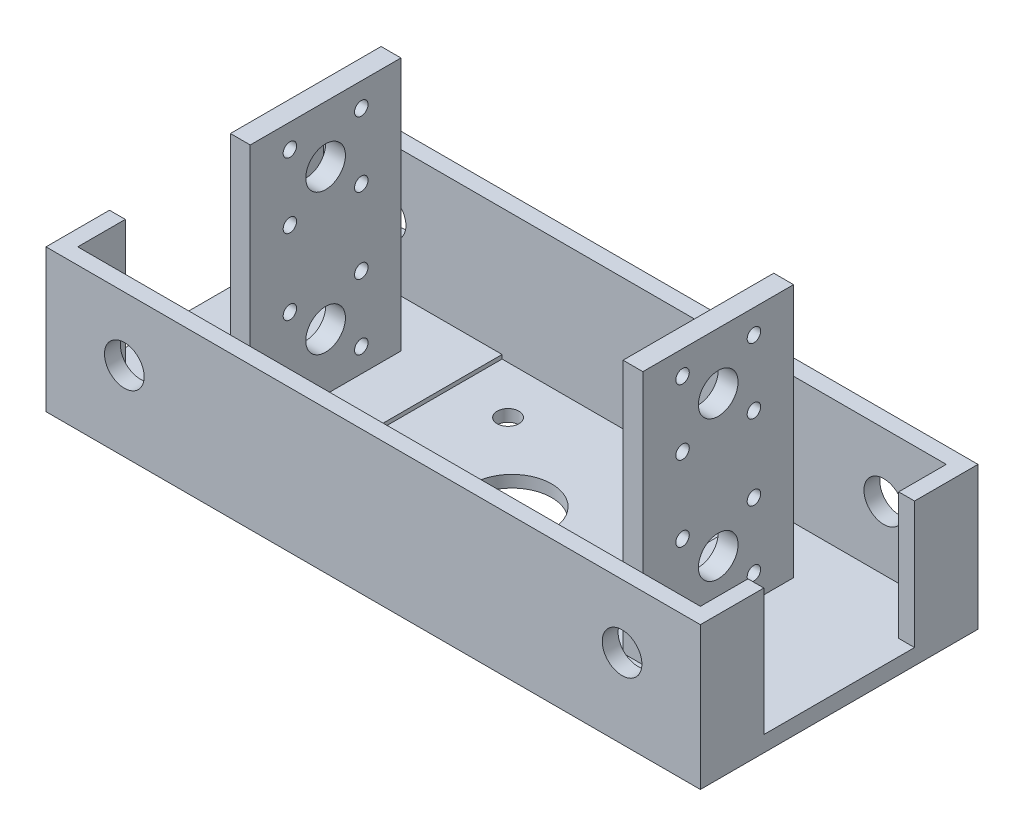
from build123d import *

# Parameters (mm, degrees)
SKETCH1_W                 = 75
SKETCH1_H                 = 40
SKETCH1_R                 = 5
SKETCH1_R_2               = 1.7
SKETCH1_W_2               = 10
SKETCH1_H_2               = 20
BOSS_EXTRUDE1_DEPTH       = 3
CUT_EXTRUDE1_DEPTH        = 43.605750786
CUT_EXTRUDE1_DEPTH_BACK   = 43.605750786
SKETCH2_W                 = 67
SKETCH2_H                 = 28
BOSS_EXTRUDE3_DEPTH       = 110
BOSS_EXTRUDE3_DEPTH_BACK  = 3
SKETCH6_W                 = 67
SKETCH6_H                 = 11
CUT_EXTRUDE4_DEPTH        = 122.372360939
SKETCH7_W                 = 70
SKETCH7_H                 = 37
BOSS_EXTRUDE4_DEPTH       = 45
SKETCH8_W                 = 45
SKETCH8_H                 = 62
CUT_EXTRUDE6_DEPTH        = 29
SKETCH11_W                = 45
SKETCH11_H                = 4
CUT_EXTRUDE9_DEPTH        = 157.445677473
SKETCH9_W                 = 38
SKETCH9_H                 = 28.5
CUT_EXTRUDE10_DEPTH       = 204.024629048
SKETCH13_W                = 5
SKETCH13_H                = 38
BOSS_EXTRUDE5_DEPTH       = 32
SKETCH14_R                = 5
SKETCH14_R_2              = 1.7
CUT_EXTRUDE11_DEPTH       = 32
SKETCH15_W                = 165
SKETCH15_H                = 70
SKETCH15_W_2              = 157
SKETCH15_H_2              = 62
BOSS_EXTRUDE6_DEPTH       = 3
SKETCH16_W                = 20
SKETCH16_H                = 4.820648258
CUT_EXTRUDE12_DEPTH       = 159.626132778
SKETCH18_R                = 5
CUT_EXTRUDE14_DEPTH       = 159.626132778
MIRROR6_COPY_1_SKETCH_W   = 5
MIRROR6_COPY_1_SKETCH_H   = 38
MIRROR6_COPY_1_DEPTH      = 32
MIRROR6_COPY_2_SKETCH_R   = 5
MIRROR6_COPY_2_SKETCH_R_2 = 1.7
MIRROR6_COPY_2_DEPTH      = 32
SKETCH19_W                = 38
SKETCH19_H                = 3.5
CUT_EXTRUDE15_DEPTH       = 10
SKETCH20_R                = 1.2
CUT_EXTRUDE16_DEPTH       = 10
SKETCH21_W                = 10
SKETCH21_H                = 80
CUT_EXTRUDE17_DEPTH       = 184.330984833
SKETCH22_W                = 55
SKETCH22_H                = 80
CUT_EXTRUDE18_DEPTH       = 184.330984833
SKETCH23_W                = 67
SKETCH23_H                = 62
BOSS_EXTRUDE7_DEPTH       = 3
SKETCH24_R                = 10
SKETCH24_R_2              = 2.75
CUT_EXTRUDE19_DEPTH       = 111.707949127


with BuildPart() as part:
    # Sketch1 → Boss-Extrude1 (new body)
    with BuildSketch(Plane(origin=(0, 0, 0), x_dir=(1, 0, 0), z_dir=(0, 1, 0))):
        Rectangle(SKETCH1_W, SKETCH1_H)
        with Locations(Location((-21, 0, 0), (0, 0, 270))):
            Circle(SKETCH1_R, mode=Mode.SUBTRACT)
        with Locations(Location((-30, 8.25, 0), (0, 0, 270))):
            Circle(SKETCH1_R_2, mode=Mode.SUBTRACT)
        with Locations(Location((-12, 8.25, 0), (0, 0, 270))):
            Circle(SKETCH1_R_2, mode=Mode.SUBTRACT)
        with Locations(Location((-12, -8.25, 0), (0, 0, 270))):
            Circle(SKETCH1_R_2, mode=Mode.SUBTRACT)
        with Locations(Location((-30, -8.25, 0), (0, 0, 270))):
            Circle(SKETCH1_R_2, mode=Mode.SUBTRACT)
        with Locations(Location((12, 8.25, 0), (0, 0, 90))):
            Circle(SKETCH1_R_2, mode=Mode.SUBTRACT)
        with Locations(Location((12, -8.25, 0), (0, 0, 90))):
            Circle(SKETCH1_R_2, mode=Mode.SUBTRACT)
        with Locations(Location((21, 0, 0), (0, 0, 90))):
            Circle(SKETCH1_R, mode=Mode.SUBTRACT)
        with Locations(Location((30, -8.25, 0), (0, 0, 90))):
            Circle(SKETCH1_R_2, mode=Mode.SUBTRACT)
        with Locations(Location((30, 8.25, 0), (0, 0, 90))):
            Circle(SKETCH1_R_2, mode=Mode.SUBTRACT)
        Rectangle(SKETCH1_W_2, SKETCH1_H_2, mode=Mode.SUBTRACT)
    extrude(amount=BOSS_EXTRUDE1_DEPTH)

    # Sketch2 → Cut-Extrude1 (cut, two sides: drawn at the far end of the back side and taken through both)
    with BuildSketch(Plane(origin=(0, 3, 0), x_dir=(1, 0, 0), z_dir=(0, 1, 0)).offset(-CUT_EXTRUDE1_DEPTH_BACK)):
        Rectangle(SKETCH2_W, SKETCH2_H)
    extrude(amount=CUT_EXTRUDE1_DEPTH + CUT_EXTRUDE1_DEPTH_BACK, mode=Mode.SUBTRACT)

    # Sketch3 → Boss-Extrude3 (add, two sides: drawn at the far end of the back side and taken through both)
    with BuildSketch(Plane(origin=(0, 3, 0), x_dir=(1, 0, 0), z_dir=(0, 1, 0)).offset(-BOSS_EXTRUDE3_DEPTH_BACK)):
        Polygon((37.5, -35), (37.5, -20), (33.5, -20), (-33.5, -20), (-37.5, -20), (-37.5, -35), align=None)
        Polygon((33.5, 20), (37.5, 20), (37.5, 35), (-37.5, 35), (-37.5, 20), (-33.5, 20), align=None)
        Polygon((37.5, -20), (37.5, 20), (33.5, 20), (33.5, 14), (33.5, -14), (33.5, -20), align=None)
        Polygon((-33.5, 14), (-33.5, 20), (-37.5, 20), (-37.5, -20), (-33.5, -20), (-33.5, -14), align=None)
    extrude(amount=BOSS_EXTRUDE3_DEPTH + BOSS_EXTRUDE3_DEPTH_BACK)

    # Sketch6 → Cut-Extrude4 (cut, through all)
    with BuildSketch(Plane(origin=(0, 3, 0), x_dir=(1, 0, 0), z_dir=(0, 1, 0))):
        with Locations((0, -25.5)):
            Rectangle(SKETCH6_W, SKETCH6_H)
        with Locations((0, 25.5)):
            Rectangle(SKETCH6_W, SKETCH6_H)
    extrude(amount=CUT_EXTRUDE4_DEPTH, mode=Mode.SUBTRACT)

    # Sketch7 → Boss-Extrude4 (add)
    with BuildSketch(Plane.ZY.offset(37.5)):
        with Locations((0, 94.5)):
            Rectangle(SKETCH7_W, SKETCH7_H)
    boss_extrude4 = extrude(amount=BOSS_EXTRUDE4_DEPTH)

    # Mirror2: Boss-Extrude4 across plane
    add(boss_extrude4.mirror(Plane(origin=(0, 0, 0), x_dir=(0, 0, 1), z_dir=(1, 0, 0))))

    # Sketch8 → Cut-Extrude6 (cut)
    with BuildSketch(Plane(origin=(0, 113, 0), x_dir=(1, 0, 0), z_dir=(0, 1, 0))):
        with Locations((-56, 0)):
            Rectangle(SKETCH8_W, SKETCH8_H)
        with Locations((56, 0)):
            Rectangle(SKETCH8_W, SKETCH8_H)
    extrude(amount=-CUT_EXTRUDE6_DEPTH, mode=Mode.SUBTRACT)

    # Sketch11 → Cut-Extrude9 (cut, through all)
    with BuildSketch(Plane.XY.offset(35)):
        with Locations((-60, 78)):
            Rectangle(SKETCH11_W, SKETCH11_H)
        with Locations((60, 78)):
            Rectangle(SKETCH11_W, SKETCH11_H)
    extrude(amount=-CUT_EXTRUDE9_DEPTH, mode=Mode.SUBTRACT)

    # Sketch9 → Cut-Extrude10 (cut, through all)
    with BuildSketch(Plane.ZY.offset(82.5)):
        with Locations((0, 98.25)):
            Rectangle(SKETCH9_W, SKETCH9_H)
    extrude(amount=-CUT_EXTRUDE10_DEPTH, mode=Mode.SUBTRACT)

    # Sketch13 → Boss-Extrude5 (add)
    with BuildSketch(Plane(origin=(0, 84, 0), x_dir=(1, 0, 0), z_dir=(0, 1, 0))):
        with Locations((-49.5, 0)):
            Rectangle(SKETCH13_W, SKETCH13_H)
    boss_extrude5 = extrude(amount=BOSS_EXTRUDE5_DEPTH)

    # Sketch14 → Cut-Extrude11 (cut)
    with BuildSketch(Plane.ZY.offset(52)):
        with Locations((0, 98.25)):
            Circle(SKETCH14_R)
        with Locations((-9, 106.5)):
            Circle(SKETCH14_R_2)
        with Locations((9, 106.5)):
            Circle(SKETCH14_R_2)
        with Locations((9, 90)):
            Circle(SKETCH14_R_2)
        with Locations((-9, 90)):
            Circle(SKETCH14_R_2)
    cut_extrude11 = extrude(amount=-CUT_EXTRUDE11_DEPTH, mode=Mode.SUBTRACT)

    # Mirror4: Boss-Extrude5, Cut-Extrude11 across plane
    add(boss_extrude5.mirror(Plane(origin=(0, 0, 0), x_dir=(0, 0, 1), z_dir=(1, 0, 0))))
    add(cut_extrude11.mirror(Plane(origin=(0, 0, 0), x_dir=(0, 0, 1), z_dir=(1, 0, 0))), mode=Mode.SUBTRACT)

    # Sketch15 → Boss-Extrude6 (add)
    with BuildSketch(Plane(origin=(0, 113, 0), x_dir=(1, 0, 0), z_dir=(0, 1, 0))):
        Rectangle(SKETCH15_W, SKETCH15_H)
        Rectangle(SKETCH15_W_2, SKETCH15_H_2, mode=Mode.SUBTRACT)
    extrude(amount=BOSS_EXTRUDE6_DEPTH)

    # Sketch16 → Cut-Extrude12 (cut, through all)
    with BuildSketch(Plane.XY.offset(35)):
        with Locations((0, 11.636111214)):
            Rectangle(SKETCH16_W, SKETCH16_H)
    extrude(amount=-CUT_EXTRUDE12_DEPTH, mode=Mode.SUBTRACT)

    # Sketch18 → Cut-Extrude14 (cut, through all)
    with BuildSketch(Plane.XY.offset(35)):
        with Locations((62.75, 100)):
            Circle(SKETCH18_R)
    cut_extrude14 = extrude(amount=-CUT_EXTRUDE14_DEPTH, mode=Mode.SUBTRACT)

    # Mirror5: Cut-Extrude14 across plane
    add(cut_extrude14.mirror(Plane(origin=(0, 0, 0), x_dir=(0, 0, 1), z_dir=(1, 0, 0))), mode=Mode.SUBTRACT)

    # Mirror6: Boss-Extrude5, Cut-Extrude11 across plane
    add(boss_extrude5.mirror(Plane.ZX.offset(116)))
    add(cut_extrude11.mirror(Plane.ZX.offset(116)), mode=Mode.SUBTRACT)

    # Mirror6 copy 1 sketch → Mirror6 copy 1 (add)
    with BuildSketch(Plane(origin=(0, 148, 0), x_dir=(-1, 0, 0), z_dir=(0, -1, 0))):
        with Locations((-49.5, 0)):
            Rectangle(MIRROR6_COPY_1_SKETCH_W, MIRROR6_COPY_1_SKETCH_H)
    extrude(amount=MIRROR6_COPY_1_DEPTH)

    # Mirror6 copy 2 sketch → Mirror6 copy 2 (cut)
    with BuildSketch(Plane(origin=(52, 232, 0), x_dir=(0, 0, 1), z_dir=(1, 0, 0))):
        with Locations((0, 98.25)):
            Circle(MIRROR6_COPY_2_SKETCH_R)
        with Locations((-9, 106.5)):
            Circle(MIRROR6_COPY_2_SKETCH_R_2)
        with Locations((9, 106.5)):
            Circle(MIRROR6_COPY_2_SKETCH_R_2)
        with Locations((9, 90)):
            Circle(MIRROR6_COPY_2_SKETCH_R_2)
        with Locations((-9, 90)):
            Circle(MIRROR6_COPY_2_SKETCH_R_2)
    extrude(amount=-MIRROR6_COPY_2_DEPTH, mode=Mode.SUBTRACT)

    # Sketch19 → Cut-Extrude15 (cut)
    with BuildSketch(Plane(origin=(82.5, 0, 0), x_dir=(0, 0, -1), z_dir=(1, 0, 0))):
        with Locations((0, 114.25)):
            Rectangle(SKETCH19_W, SKETCH19_H)
    cut_extrude15 = extrude(amount=-CUT_EXTRUDE15_DEPTH, mode=Mode.SUBTRACT)

    # Mirror7: Cut-Extrude15 across plane
    add(cut_extrude15.mirror(Plane(origin=(0, 0, 0), x_dir=(0, 0, 1), z_dir=(1, 0, 0))), mode=Mode.SUBTRACT)

    # Sketch20 → Cut-Extrude16 (cut)
    with BuildSketch(Plane(origin=(0, 3, 0), x_dir=(1, 0, 0), z_dir=(0, 1, 0))):
        with Locations(Location((-24, 17.5, 0), (0, 0, 270))):
            Circle(SKETCH20_R)
        with Locations(Location((-12, 17.5, 0), (0, 0, 270))):
            Circle(SKETCH20_R)
        with Locations(Location((12, 17.5, 0), (0, 0, 270))):
            Circle(SKETCH20_R)
        with Locations(Location((-24, -17.5, 0), (0, 0, 270))):
            Circle(SKETCH20_R)
        with Locations(Location((-12, -17.5, 0), (0, 0, 270))):
            Circle(SKETCH20_R)
        with Locations(Location((24, 17.5, 0), (0, 0, 270))):
            Circle(SKETCH20_R)
        with Locations(Location((12, -17.5, 0), (0, 0, 270))):
            Circle(SKETCH20_R)
        with Locations(Location((24, -17.5, 0), (0, 0, 270))):
            Circle(SKETCH20_R)
    extrude(amount=-CUT_EXTRUDE16_DEPTH, mode=Mode.SUBTRACT)

    # Sketch21 → Cut-Extrude17 (cut, through all)
    with BuildSketch(Plane.XY.offset(35)):
        with Locations((32.5, 40)):
            Rectangle(SKETCH21_W, SKETCH21_H)
        with Locations((-32.5, 40)):
            Rectangle(SKETCH21_W, SKETCH21_H)
    extrude(amount=-CUT_EXTRUDE17_DEPTH, mode=Mode.SUBTRACT)

    # Sketch22 → Cut-Extrude18 (cut, through all)
    with BuildSketch(Plane.XY.offset(35)):
        with Locations((0, 40)):
            Rectangle(SKETCH22_W, SKETCH22_H)
    extrude(amount=-CUT_EXTRUDE18_DEPTH, mode=Mode.SUBTRACT)

    # Sketch23 → Boss-Extrude7 (add)
    with BuildSketch(Plane.XZ.offset(-80)):
        Rectangle(SKETCH23_W, SKETCH23_H)
    extrude(amount=-BOSS_EXTRUDE7_DEPTH)

    # Sketch24 → Cut-Extrude19 (cut, through all)
    with BuildSketch(Plane(origin=(0, 83, 0), x_dir=(1, 0, 0), z_dir=(0, 1, 0))):
        with Locations(Location((0, 0, 0), (0, 0, 270))):
            Circle(SKETCH24_R)
        with Locations(Location((-20, 19, 0), (0, 0, 270))):
            Circle(SKETCH24_R_2)
        with Locations(Location((-20, -19, 0), (0, 0, 270))):
            Circle(SKETCH24_R_2)
        with Locations(Location((20, -19, 0), (0, 0, 90))):
            Circle(SKETCH24_R_2)
        with Locations(Location((20, 19, 0), (0, 0, 90))):
            Circle(SKETCH24_R_2)
    extrude(amount=-CUT_EXTRUDE19_DEPTH, mode=Mode.SUBTRACT)


solid = part.part
